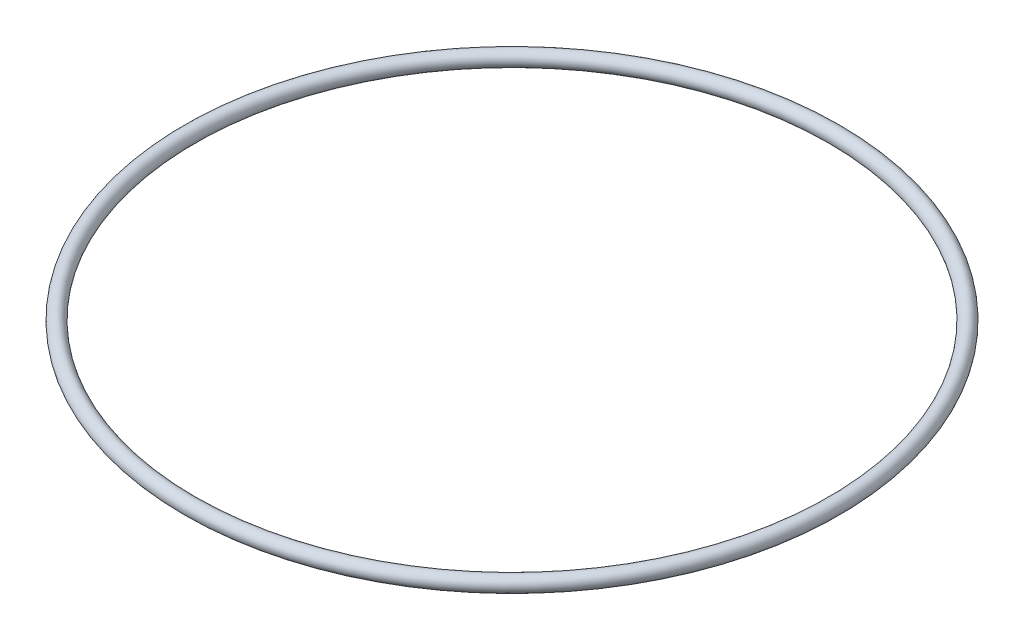
from build123d import *

# Parameters (mm, degrees)
SKETCH1_R = 1.05


with BuildPart() as part:
    # Sketch1 → Revolve1 (revolve)
    with BuildSketch(Plane(origin=(0, 0, 0), x_dir=(0, 0, -1), z_dir=(1, 0, 0))):
        with Locations((45.375, 0)):
            Circle(SKETCH1_R)
    revolve(axis=Axis((0, 0, 0), (0, 1, 0)))


solid = part.part
